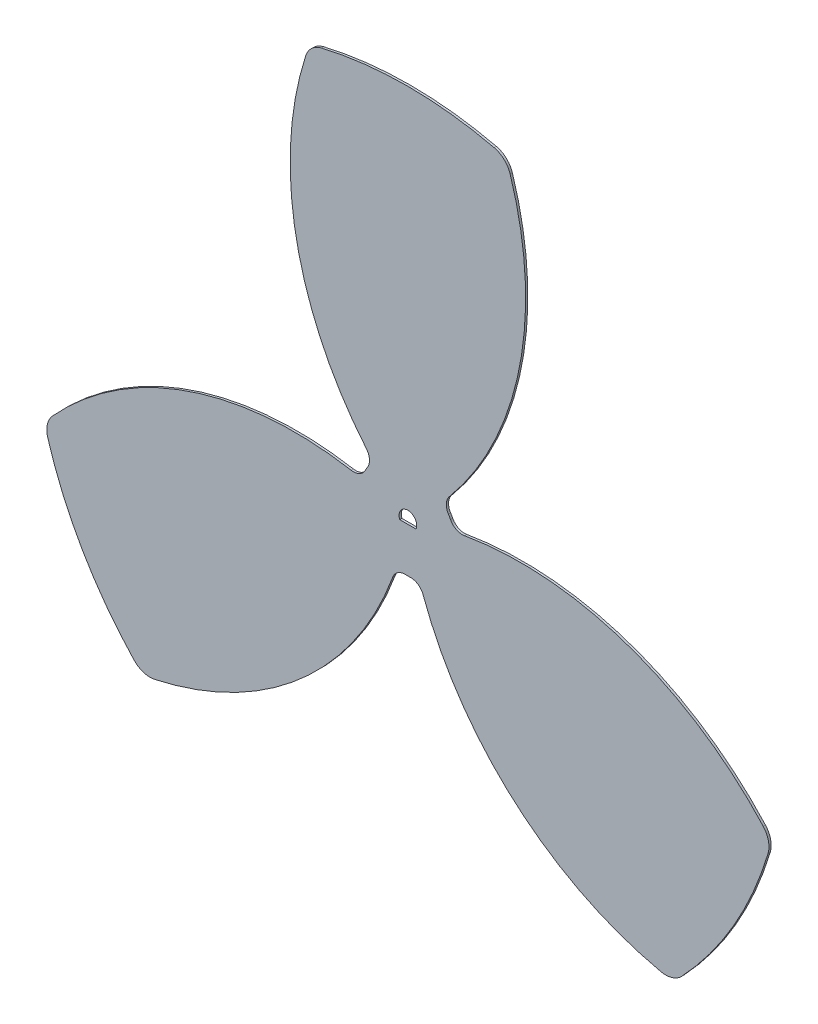
from build123d import *

# Parameters (mm, degrees)
ESQUISSE2_R             = 21.716757685
BOSS_EXTRU_1_DEPTH      = 1
ENL_V_MAT_EXTRU_2_DEPTH = 293.837814183
CONG_2_R                = 10
CONG_3_R                = 6
CONG_4_R                = 6
CONG_5_R                = 6


with BuildPart() as part:
    # Esquisse2 → Boss.-Extru.1 (new body)
    with BuildSketch(Plane.XY):
        with Locations((-43.22899501, 36.585487108)):
            Circle(ESQUISSE2_R)
        with BuildLine():
            ThreePointArc((-207.546192285, -7.001881243), (-132.259115873, 40.696309579), (-43.22899501, 36.585487108))
            ThreePointArc((-43.22899501, 36.585487108), (-84.183978752, -42.572270496), (-163.135361924, -83.923695834))
            ThreePointArc((-163.135361924, -83.923695834), (-190.453313653, -48.414512892), (-207.546192285, -7.001881243))
        make_face()
        with BuildLine():
            ThreePointArc((76.677371904, -83.923695834), (-2.274011269, -42.572270496), (-43.22899501, 36.585487108))
            ThreePointArc((-43.22899501, 36.585487108), (45.801125853, 40.696309579), (121.088202265, -7.001881243))
            ThreePointArc((121.088202265, -7.001881243), (103.995323633, -48.414512892), (76.677371904, -83.923695834))
        make_face()
        with BuildLine():
            Line((-43.22899501, 206.585487108), (-43.22899501, 58.302244794))
            ThreePointArc((-43.22899501, 58.302244794), (-34.753748483, 56.580180421), (-27.622617897, 51.687094896))
            ThreePointArc((-27.622617897, 51.687094896), (7.298277527, 122.217794206), (1.181835351, 200.682038403))
            ThreePointArc((1.181835351, 200.682038403), (-20.82825529, 205.103162324), (-43.22899501, 206.585487108))
        make_face()
        with BuildLine():
            ThreePointArc((-58.835372123, 51.687094896), (-51.704241537, 56.580180421), (-43.22899501, 58.302244794))
            Line((-43.22899501, 58.302244794), (-43.22899501, 206.585487108))
            ThreePointArc((-43.22899501, 206.585487108), (-65.62973473, 205.103162324), (-87.639825371, 200.682038403))
            ThreePointArc((-87.639825371, 200.682038403), (-93.756267547, 122.217794206), (-58.835372123, 51.687094896))
        make_face()
        with BuildLine():
            ThreePointArc((-48.504182436, 15.519164174), (-45.480177087, 25.955564863), (-43.22899501, 36.585487108))
            ThreePointArc((-43.22899501, 36.585487108), (-53.560368754, 39.950867364), (-64.110559549, 42.550202255))
            ThreePointArc((-64.110559549, 42.550202255), (-62.036258854, 25.727108266), (-48.504182436, 15.519164174))
        make_face()
        with BuildLine():
            ThreePointArc((-22.347430471, 42.550202255), (-32.897621267, 39.950867364), (-43.22899501, 36.585487108))
            ThreePointArc((-43.22899501, 36.585487108), (-40.977812933, 25.955564863), (-37.953807584, 15.519164174))
            ThreePointArc((-37.953807584, 15.519164174), (-26.109159563, 23.224020174), (-21.512237325, 36.585487108))
            ThreePointArc((-21.512237325, 36.585487108), (-21.722049137, 39.596939182), (-22.347430471, 42.550202255))
        make_face()
        with BuildLine():
            ThreePointArc((-37.953807584, 15.519164174), (-40.977812933, 25.955564863), (-43.22899501, 36.585487108))
            ThreePointArc((-43.22899501, 36.585487108), (-45.480177087, 25.955564863), (-48.504182436, 15.519164174))
            ThreePointArc((-48.504182436, 15.519164174), (-43.22899501, 14.868729423), (-37.953807584, 15.519164174))
        make_face()
        with BuildLine():
            ThreePointArc((-64.110559549, 42.550202255), (-53.560368754, 39.950867364), (-43.22899501, 36.585487108))
            ThreePointArc((-43.22899501, 36.585487108), (-51.309186676, 43.850029099), (-58.835372123, 51.687094896))
            ThreePointArc((-58.835372123, 51.687094896), (-62.036258854, 47.443865951), (-64.110559549, 42.550202255))
        make_face()
        with BuildLine():
            ThreePointArc((-58.835372123, 51.687094896), (-51.309186676, 43.850029099), (-43.22899501, 36.585487108))
            Line((-43.22899501, 36.585487108), (-43.22899501, 58.302244794))
            ThreePointArc((-43.22899501, 58.302244794), (-51.704241537, 56.580180421), (-58.835372123, 51.687094896))
        make_face()
        with BuildLine():
            Line((-43.22899501, 58.302244794), (-43.22899501, 36.585487108))
            ThreePointArc((-43.22899501, 36.585487108), (-35.148803344, 43.850029099), (-27.622617897, 51.687094896))
            ThreePointArc((-27.622617897, 51.687094896), (-34.753748483, 56.580180421), (-43.22899501, 58.302244794))
        make_face()
        with BuildLine():
            ThreePointArc((-27.622617897, 51.687094896), (-35.148803344, 43.850029099), (-43.22899501, 36.585487108))
            ThreePointArc((-43.22899501, 36.585487108), (-32.897621267, 39.950867364), (-22.347430471, 42.550202255))
            ThreePointArc((-22.347430471, 42.550202255), (-24.421731167, 47.443865951), (-27.622617897, 51.687094896))
        make_face()
    extrude(amount=BOSS_EXTRU_1_DEPTH)

    # Esquisse4 → Enlèv. mat.-Extru.2 (cut, through all)
    with BuildSketch(Plane(origin=(0, 0, 0), x_dir=(-1, 0, 0), z_dir=(0, 0, -1))):
        with BuildLine():
            Line((46.937094254, 35.085487108), (39.520895767, 35.085487108))
            ThreePointArc((39.520895767, 35.085487108), (43.22899501, 40.585487108), (46.937094254, 35.085487108))
        make_face()
    extrude(amount=-ENL_V_MAT_EXTRU_2_DEPTH, mode=Mode.SUBTRACT)

    # Congé2
    cong_2_edges = [part.edges().sort_by_distance(p)[0] for p in [
        (-87.639825371, 200.682038403, 0.5),
        (1.181835351, 200.682038403, 0.5),
        (121.088202265, -7.001881243, 0.5),
        (76.677371904, -83.923695834, 0.5),
        (-163.135361924, -83.923695834, 0.5),
        (-207.546192285, -7.001881243, 0.5),
    ]]
    fillet(cong_2_edges, radius=CONG_2_R)

    # Congé3
    cong_3_edges = [part.edges().sort_by_distance(p)[0] for p in [
        (-64.110559549, 42.550202255, 0.5),
        (-58.835372123, 51.687094896, 0.5),
    ]]
    fillet(cong_3_edges, radius=CONG_3_R)

    # Congé4
    cong_4_edges = [part.edges().sort_by_distance(p)[0] for p in [
        (-27.622617897, 51.687094896, 0.5),
        (-22.347430471, 42.550202255, 0.5),
    ]]
    fillet(cong_4_edges, radius=CONG_4_R)

    # Congé5
    cong_5_edges = [part.edges().sort_by_distance(p)[0] for p in [
        (-37.953807584, 15.519164174, 0.5),
        (-48.504182436, 15.519164174, 0.5),
    ]]
    fillet(cong_5_edges, radius=CONG_5_R)


solid = part.part
